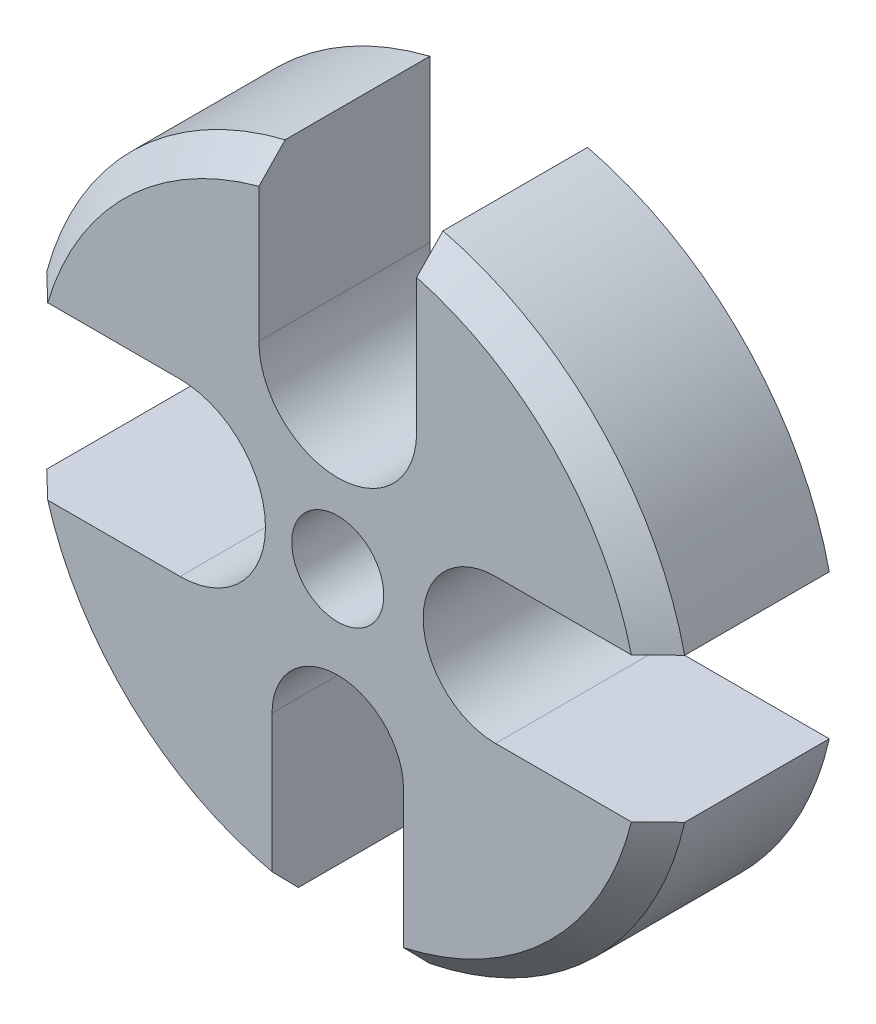
from build123d import *

# Parameters (mm, degrees)
SKETCH1_R           = 3.5
BOSS_EXTRUDE1_DEPTH = 13
CHAMFER1_SIZE       = 2


with BuildPart() as part:
    # Sketch1 → Boss-Extrude1 (new body)
    with BuildSketch(Plane.XY):
        with BuildLine():
            ThreePointArc((24.387496797, 5.5), (17.858383307, 17.495089187), (6, 24.269322199))
            Line((6, 24.269322199), (6, 12))
            ThreePointArc((6, 12), (0, 6), (-6, 12))
            Line((-6, 12), (-6, 24.269322199))
            ThreePointArc((-6, 24.269322199), (-17.494151854, 17.859301524), (-24.140215409, 6.5))
            Line((-24.140215409, 6.5), (-12, 6.5))
            ThreePointArc((-12, 6.5), (-5.5, 0), (-12, -6.5))
            Line((-12, -6.5), (-24.140215409, -6.5))
            ThreePointArc((-24.140215409, -6.5), (-17.124313764, -18.214221864), (-5, -24.494897428))
            Line((-5, -24.494897428), (-5, -12))
            ThreePointArc((-5, -12), (0, -7), (5, -12))
            Line((5, -12), (5, -24.494897428))
            ThreePointArc((5, -24.494897428), (17.49593593, -17.85755375), (24.387496797, -5.5))
            Line((24.387496797, -5.5), (12, -5.5))
            ThreePointArc((12, -5.5), (6.5, 0), (12, 5.5))
            Line((12, 5.5), (24.387496797, 5.5))
        make_face()
        with Locations(Location((0, 0, 0), (0, 0, 180))):
            Circle(SKETCH1_R, mode=Mode.SUBTRACT)
    extrude(amount=BOSS_EXTRUDE1_DEPTH)

    # Chamfer1
    chamfer1_edges = [part.edges().sort_by_distance(p)[0] for p in [
        (17.49593593, -17.85755375, 13),
        (17.858383307, 17.495089187, 13),
        (-17.494151854, 17.859301524, 13),
        (-17.124313764, -18.214221864, 13),
    ]]
    chamfer(chamfer1_edges, length=CHAMFER1_SIZE)


solid = part.part
